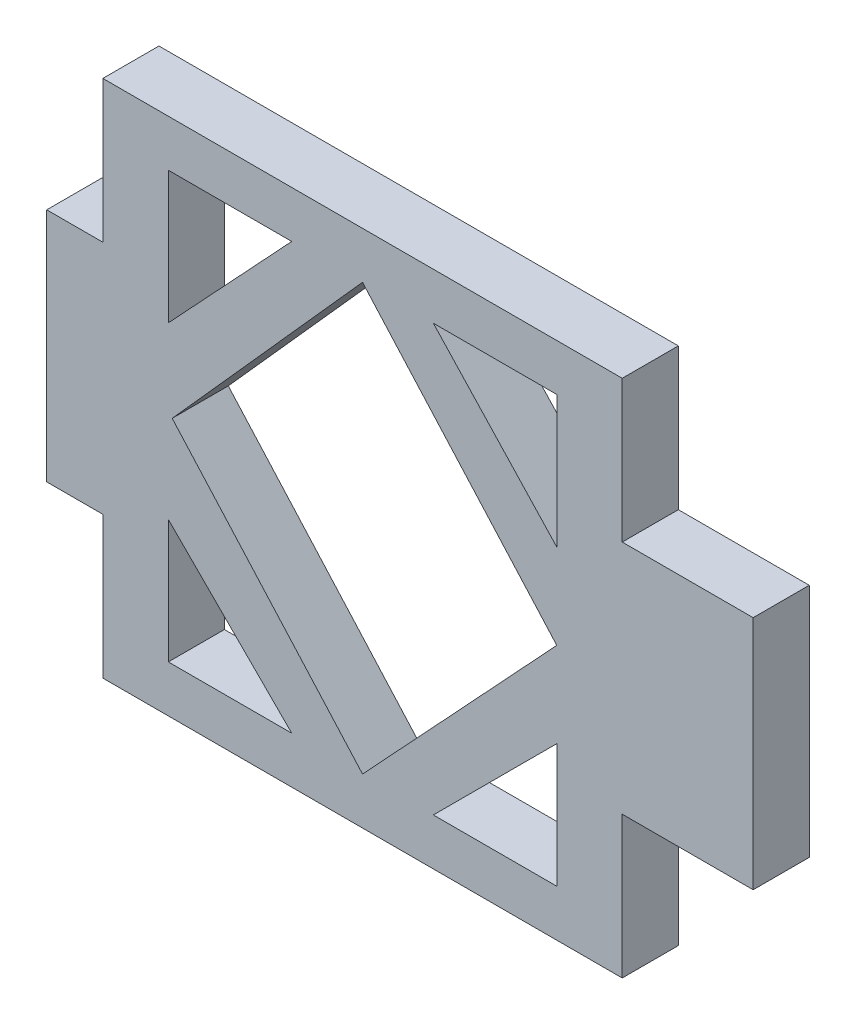
from build123d import *

# Parameters (mm, degrees)
SALIENTE_EXTRUIR1_DEPTH = 3


with BuildPart() as part:
    # Croquis1 → Saliente-Extruir1 (new body)
    with BuildSketch(Plane.XY):
        Polygon((97.334837859, 52.056418279), (97.334837859, 39.456418279), (100.334837859, 39.456418279), (100.334837859, 31.871418279), (128.104837859, 31.871418279), (128.104837859, 39.456418279), (135.104837859, 39.456418279), (135.104837859, 52.056418279), (128.104837859, 52.056418279), (128.104837859, 59.641418279), (100.334837859, 59.641418279), (100.334837859, 52.056418279), align=None)
        Polygon((110.434837859, 57.141418279), (103.834837859, 57.141418279), (103.834837859, 50.071418279), align=None, mode=Mode.SUBTRACT)
        Polygon((103.834837859, 40.971418279), (103.834837859, 34.371418279), (110.434837859, 34.371418279), align=None, mode=Mode.SUBTRACT)
        Polygon((118.004837859, 34.371418279), (124.604837859, 34.371418279), (124.604837859, 40.971418279), align=None, mode=Mode.SUBTRACT)
        Polygon((124.604837859, 50.076418279), (124.604837859, 57.141418279), (118.004837859, 57.141418279), align=None, mode=Mode.SUBTRACT)
        Polygon((114.219837859, 57.141418279), (124.604837859, 45.523918279), (114.219837859, 34.371418279), (104.042671946, 45.756418279), align=None, mode=Mode.SUBTRACT)
    extrude(amount=SALIENTE_EXTRUIR1_DEPTH)


solid = part.part
